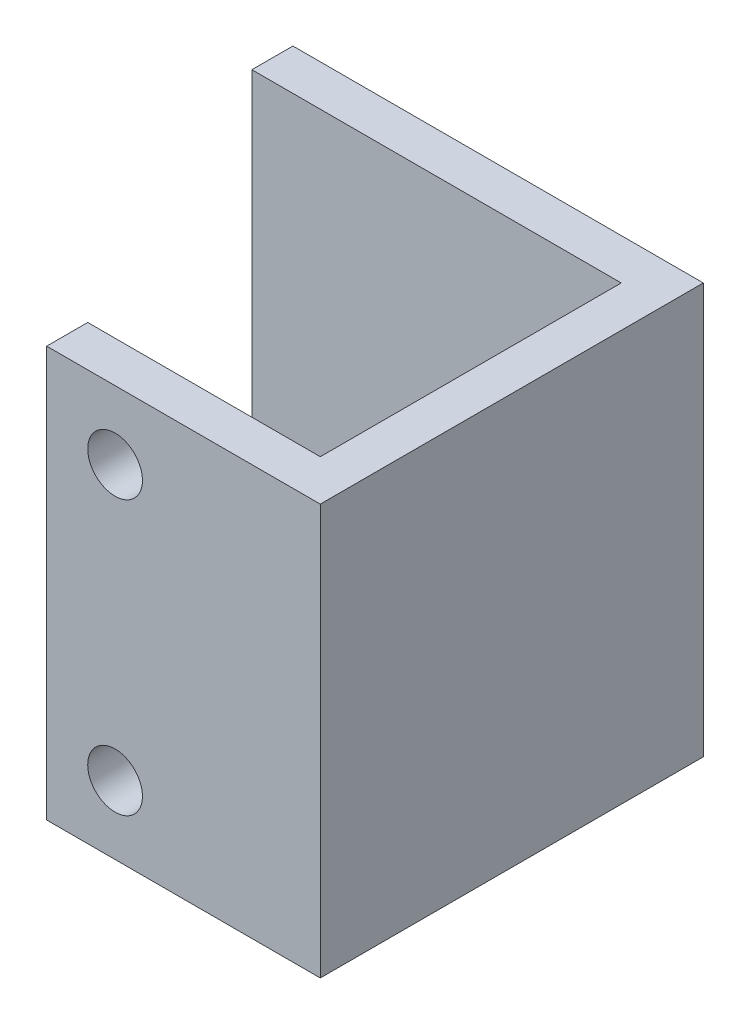
from build123d import *

# Parameters (mm, degrees)
SKETCH_1_W      = 30
SKETCH_1_H      = 30
EXTRUDE_1_DEPTH = 3
SKETCH_2_W      = 3
SKETCH_2_H      = 30
EXTRUDE_2_DEPTH = 22
SKETCH_3_W      = 20
SKETCH_3_H      = 30
SKETCH_3_R      = 2
EXTRUDE_3_DEPTH = 3


with BuildPart() as part:
    # 草图1 → 凸台-拉伸1 (new body)
    with BuildSketch(Plane.XY):
        Rectangle(SKETCH_1_W, SKETCH_1_H)
    extrude(amount=EXTRUDE_1_DEPTH)

    # 草图2 → 凸台-拉伸2 (add)
    with BuildSketch(Plane.XY.offset(3)):
        with Locations((13.5, 0)):
            Rectangle(SKETCH_2_W, SKETCH_2_H)
    extrude(amount=EXTRUDE_2_DEPTH)

    # 草图3 → 凸台-拉伸3 (add)
    with BuildSketch(Plane.XY.offset(25)):
        with Locations((5, 0)):
            Rectangle(SKETCH_3_W, SKETCH_3_H)
        with Locations((0, 10)):
            Circle(SKETCH_3_R, mode=Mode.SUBTRACT)
        with Locations(Location((0, -10, 0), (0, 0, 180))):
            Circle(SKETCH_3_R, mode=Mode.SUBTRACT)
    extrude(amount=EXTRUDE_3_DEPTH)


solid = part.part
